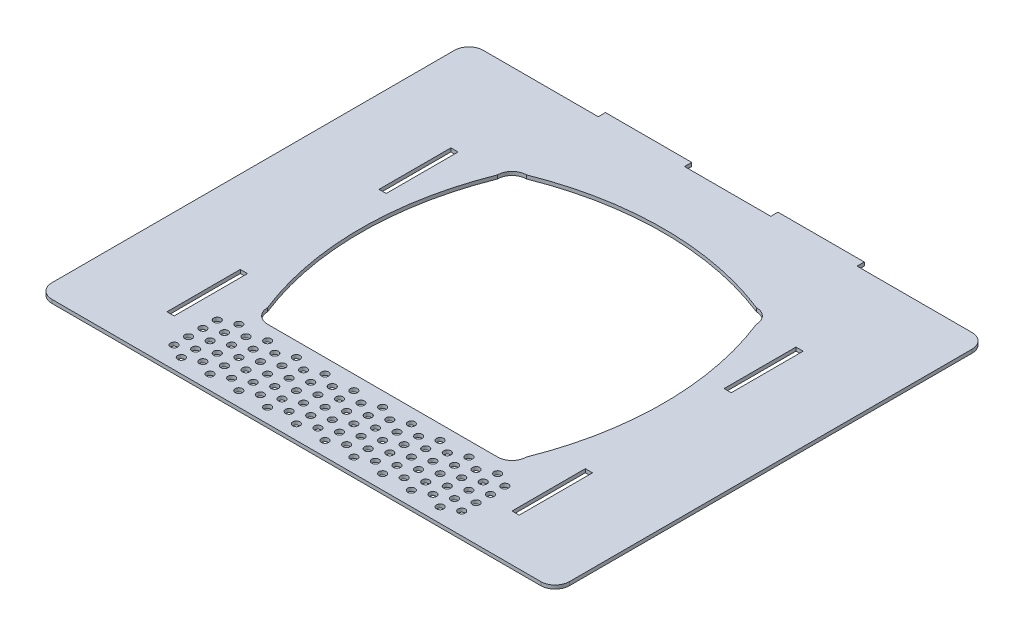
from build123d import *

# Parameters (mm, degrees)
SKETCH1_4_R         = 2.5
SKETCH1_4_W         = 5
SKETCH1_4_H         = 51
SKETCH1_4_H_2       = 50
BOSS_EXTRUDE3_DEPTH = 2.5
FILLET8_R           = 10


with BuildPart() as part:
    # Sketch1<4> → Boss-Extrude3 (new body)
    with BuildSketch(Plane(origin=(0, 0, 0), x_dir=(1, 0, 0), z_dir=(0, 1, 0))):
        Polygon((-90, 150), (-180, 150), (-180, -150), (180, -150), (180, 150), (90, 150), (90, 155), (30, 155), (30, 150), (-30, 150), (-30, 155), (-90, 155), align=None)
        with Locations((-90, -140)):
            Circle(SKETCH1_4_R, mode=Mode.SUBTRACT)
        with Locations((-100, -135)):
            Circle(SKETCH1_4_R, mode=Mode.SUBTRACT)
        with Locations((-90, -130)):
            Circle(SKETCH1_4_R, mode=Mode.SUBTRACT)
        with Locations((-100, -125)):
            Circle(SKETCH1_4_R, mode=Mode.SUBTRACT)
        with Locations((-90, -120)):
            Circle(SKETCH1_4_R, mode=Mode.SUBTRACT)
        with Locations((-100, -115)):
            Circle(SKETCH1_4_R, mode=Mode.SUBTRACT)
        with Locations((-120, -92)):
            Rectangle(SKETCH1_4_W, SKETCH1_4_H, mode=Mode.SUBTRACT)
        with Locations((-90, -110)):
            Circle(SKETCH1_4_R, mode=Mode.SUBTRACT)
        with Locations((-100, -105)):
            Circle(SKETCH1_4_R, mode=Mode.SUBTRACT)
        with Locations((-90, -100)):
            Circle(SKETCH1_4_R, mode=Mode.SUBTRACT)
        with Locations((-80, -135)):
            Circle(SKETCH1_4_R, mode=Mode.SUBTRACT)
        with Locations((-70, -140)):
            Circle(SKETCH1_4_R, mode=Mode.SUBTRACT)
        with Locations((-60, -135)):
            Circle(SKETCH1_4_R, mode=Mode.SUBTRACT)
        with Locations((-50, -140)):
            Circle(SKETCH1_4_R, mode=Mode.SUBTRACT)
        with Locations((-80, -125)):
            Circle(SKETCH1_4_R, mode=Mode.SUBTRACT)
        with Locations((-70, -130)):
            Circle(SKETCH1_4_R, mode=Mode.SUBTRACT)
        with Locations((-80, -115)):
            Circle(SKETCH1_4_R, mode=Mode.SUBTRACT)
        with Locations((-70, -120)):
            Circle(SKETCH1_4_R, mode=Mode.SUBTRACT)
        with Locations((-60, -125)):
            Circle(SKETCH1_4_R, mode=Mode.SUBTRACT)
        with Locations((-50, -130)):
            Circle(SKETCH1_4_R, mode=Mode.SUBTRACT)
        with Locations((-60, -115)):
            Circle(SKETCH1_4_R, mode=Mode.SUBTRACT)
        with Locations((-50, -120)):
            Circle(SKETCH1_4_R, mode=Mode.SUBTRACT)
        with Locations((-40, -135)):
            Circle(SKETCH1_4_R, mode=Mode.SUBTRACT)
        with Locations((-30, -140)):
            Circle(SKETCH1_4_R, mode=Mode.SUBTRACT)
        with Locations((-20, -135)):
            Circle(SKETCH1_4_R, mode=Mode.SUBTRACT)
        with Locations((-10, -140)):
            Circle(SKETCH1_4_R, mode=Mode.SUBTRACT)
        with Locations((0, -135)):
            Circle(SKETCH1_4_R, mode=Mode.SUBTRACT)
        with Locations((-40, -125)):
            Circle(SKETCH1_4_R, mode=Mode.SUBTRACT)
        with Locations((-30, -130)):
            Circle(SKETCH1_4_R, mode=Mode.SUBTRACT)
        with Locations((-40, -115)):
            Circle(SKETCH1_4_R, mode=Mode.SUBTRACT)
        with Locations((-30, -120)):
            Circle(SKETCH1_4_R, mode=Mode.SUBTRACT)
        with Locations((-20, -125)):
            Circle(SKETCH1_4_R, mode=Mode.SUBTRACT)
        with Locations((-10, -130)):
            Circle(SKETCH1_4_R, mode=Mode.SUBTRACT)
        with Locations((0, -125)):
            Circle(SKETCH1_4_R, mode=Mode.SUBTRACT)
        with Locations((-20, -115)):
            Circle(SKETCH1_4_R, mode=Mode.SUBTRACT)
        with Locations((-10, -120)):
            Circle(SKETCH1_4_R, mode=Mode.SUBTRACT)
        with Locations((0, -115)):
            Circle(SKETCH1_4_R, mode=Mode.SUBTRACT)
        with Locations((-80, -105)):
            Circle(SKETCH1_4_R, mode=Mode.SUBTRACT)
        with Locations((-70, -110)):
            Circle(SKETCH1_4_R, mode=Mode.SUBTRACT)
        with Locations((-70, -100)):
            Circle(SKETCH1_4_R, mode=Mode.SUBTRACT)
        with Locations((-60, -105)):
            Circle(SKETCH1_4_R, mode=Mode.SUBTRACT)
        with Locations((-50, -110)):
            Circle(SKETCH1_4_R, mode=Mode.SUBTRACT)
        with Locations((-50, -100)):
            Circle(SKETCH1_4_R, mode=Mode.SUBTRACT)
        with Locations((-40, -105)):
            Circle(SKETCH1_4_R, mode=Mode.SUBTRACT)
        with Locations((-30, -110)):
            Circle(SKETCH1_4_R, mode=Mode.SUBTRACT)
        with Locations((-30, -100)):
            Circle(SKETCH1_4_R, mode=Mode.SUBTRACT)
        with Locations((-20, -105)):
            Circle(SKETCH1_4_R, mode=Mode.SUBTRACT)
        with Locations((-10, -110)):
            Circle(SKETCH1_4_R, mode=Mode.SUBTRACT)
        with Locations((0, -105)):
            Circle(SKETCH1_4_R, mode=Mode.SUBTRACT)
        with Locations((-10, -100)):
            Circle(SKETCH1_4_R, mode=Mode.SUBTRACT)
        with Locations((10, -140)):
            Circle(SKETCH1_4_R, mode=Mode.SUBTRACT)
        with Locations((20, -135)):
            Circle(SKETCH1_4_R, mode=Mode.SUBTRACT)
        with Locations((30, -140)):
            Circle(SKETCH1_4_R, mode=Mode.SUBTRACT)
        with Locations((40, -135)):
            Circle(SKETCH1_4_R, mode=Mode.SUBTRACT)
        with Locations((10, -130)):
            Circle(SKETCH1_4_R, mode=Mode.SUBTRACT)
        with Locations((20, -125)):
            Circle(SKETCH1_4_R, mode=Mode.SUBTRACT)
        with Locations((10, -120)):
            Circle(SKETCH1_4_R, mode=Mode.SUBTRACT)
        with Locations((20, -115)):
            Circle(SKETCH1_4_R, mode=Mode.SUBTRACT)
        with Locations((30, -130)):
            Circle(SKETCH1_4_R, mode=Mode.SUBTRACT)
        with Locations((40, -125)):
            Circle(SKETCH1_4_R, mode=Mode.SUBTRACT)
        with Locations((30, -120)):
            Circle(SKETCH1_4_R, mode=Mode.SUBTRACT)
        with Locations((40, -115)):
            Circle(SKETCH1_4_R, mode=Mode.SUBTRACT)
        with Locations((50, -140)):
            Circle(SKETCH1_4_R, mode=Mode.SUBTRACT)
        with Locations((60, -135)):
            Circle(SKETCH1_4_R, mode=Mode.SUBTRACT)
        with Locations((70, -140)):
            Circle(SKETCH1_4_R, mode=Mode.SUBTRACT)
        with Locations((90, -140)):
            Circle(SKETCH1_4_R, mode=Mode.SUBTRACT)
        with Locations((80, -135)):
            Circle(SKETCH1_4_R, mode=Mode.SUBTRACT)
        with Locations((50, -130)):
            Circle(SKETCH1_4_R, mode=Mode.SUBTRACT)
        with Locations((60, -125)):
            Circle(SKETCH1_4_R, mode=Mode.SUBTRACT)
        with Locations((50, -120)):
            Circle(SKETCH1_4_R, mode=Mode.SUBTRACT)
        with Locations((60, -115)):
            Circle(SKETCH1_4_R, mode=Mode.SUBTRACT)
        with Locations((70, -130)):
            Circle(SKETCH1_4_R, mode=Mode.SUBTRACT)
        with Locations((90, -130)):
            Circle(SKETCH1_4_R, mode=Mode.SUBTRACT)
        with Locations((80, -125)):
            Circle(SKETCH1_4_R, mode=Mode.SUBTRACT)
        with Locations((70, -120)):
            Circle(SKETCH1_4_R, mode=Mode.SUBTRACT)
        with Locations((90, -120)):
            Circle(SKETCH1_4_R, mode=Mode.SUBTRACT)
        with Locations((80, -115)):
            Circle(SKETCH1_4_R, mode=Mode.SUBTRACT)
        with Locations((10, -110)):
            Circle(SKETCH1_4_R, mode=Mode.SUBTRACT)
        with Locations((20, -105)):
            Circle(SKETCH1_4_R, mode=Mode.SUBTRACT)
        with Locations((10, -100)):
            Circle(SKETCH1_4_R, mode=Mode.SUBTRACT)
        with Locations((30, -110)):
            Circle(SKETCH1_4_R, mode=Mode.SUBTRACT)
        with Locations((40, -105)):
            Circle(SKETCH1_4_R, mode=Mode.SUBTRACT)
        with Locations((30, -100)):
            Circle(SKETCH1_4_R, mode=Mode.SUBTRACT)
        with Locations((50, -110)):
            Circle(SKETCH1_4_R, mode=Mode.SUBTRACT)
        with Locations((60, -105)):
            Circle(SKETCH1_4_R, mode=Mode.SUBTRACT)
        with Locations((50, -100)):
            Circle(SKETCH1_4_R, mode=Mode.SUBTRACT)
        with Locations((70, -110)):
            Circle(SKETCH1_4_R, mode=Mode.SUBTRACT)
        with Locations((90, -110)):
            Circle(SKETCH1_4_R, mode=Mode.SUBTRACT)
        with Locations((80, -105)):
            Circle(SKETCH1_4_R, mode=Mode.SUBTRACT)
        with Locations((70, -100)):
            Circle(SKETCH1_4_R, mode=Mode.SUBTRACT)
        with Locations((90, -100)):
            Circle(SKETCH1_4_R, mode=Mode.SUBTRACT)
        with Locations((100, -135)):
            Circle(SKETCH1_4_R, mode=Mode.SUBTRACT)
        with Locations((100, -125)):
            Circle(SKETCH1_4_R, mode=Mode.SUBTRACT)
        with Locations((100, -115)):
            Circle(SKETCH1_4_R, mode=Mode.SUBTRACT)
        with Locations((100, -105)):
            Circle(SKETCH1_4_R, mode=Mode.SUBTRACT)
        with Locations((120, -92)):
            Rectangle(SKETCH1_4_W, SKETCH1_4_H, mode=Mode.SUBTRACT)
        with Locations((-120, 55)):
            Rectangle(SKETCH1_4_W, SKETCH1_4_H_2, mode=Mode.SUBTRACT)
        with BuildLine():
            ThreePointArc((-90, 80), (-87.071067812, 87.071067812), (-80, 90))
            ThreePointArc((-80, 90), (0, 105.314802235), (80, 90))
            ThreePointArc((80, 90), (87.071067812, 87.071067812), (90, 80))
            ThreePointArc((90, 80), (105.314802235, 0), (90, -80))
            ThreePointArc((90, -80), (87.071067812, -87.071067812), (80, -90))
            Line((80, -90), (-80, -90))
            ThreePointArc((-80, -90), (-87.071067812, -87.071067812), (-90, -80))
            ThreePointArc((-90, -80), (-105.314802235, 0), (-90, 80))
        make_face(mode=Mode.SUBTRACT)
        with Locations((120, 55)):
            Rectangle(SKETCH1_4_W, SKETCH1_4_H_2, mode=Mode.SUBTRACT)
    extrude(amount=BOSS_EXTRUDE3_DEPTH)

    # Fillet8
    fillet8_edges = [part.edges().sort_by_distance(p)[0] for p in [
        (180, 1.25, -150),
        (-180, 1.25, -150),
        (180, 1.25, 150),
        (-180, 1.25, 150),
    ]]
    fillet(fillet8_edges, radius=FILLET8_R)


solid = part.part
